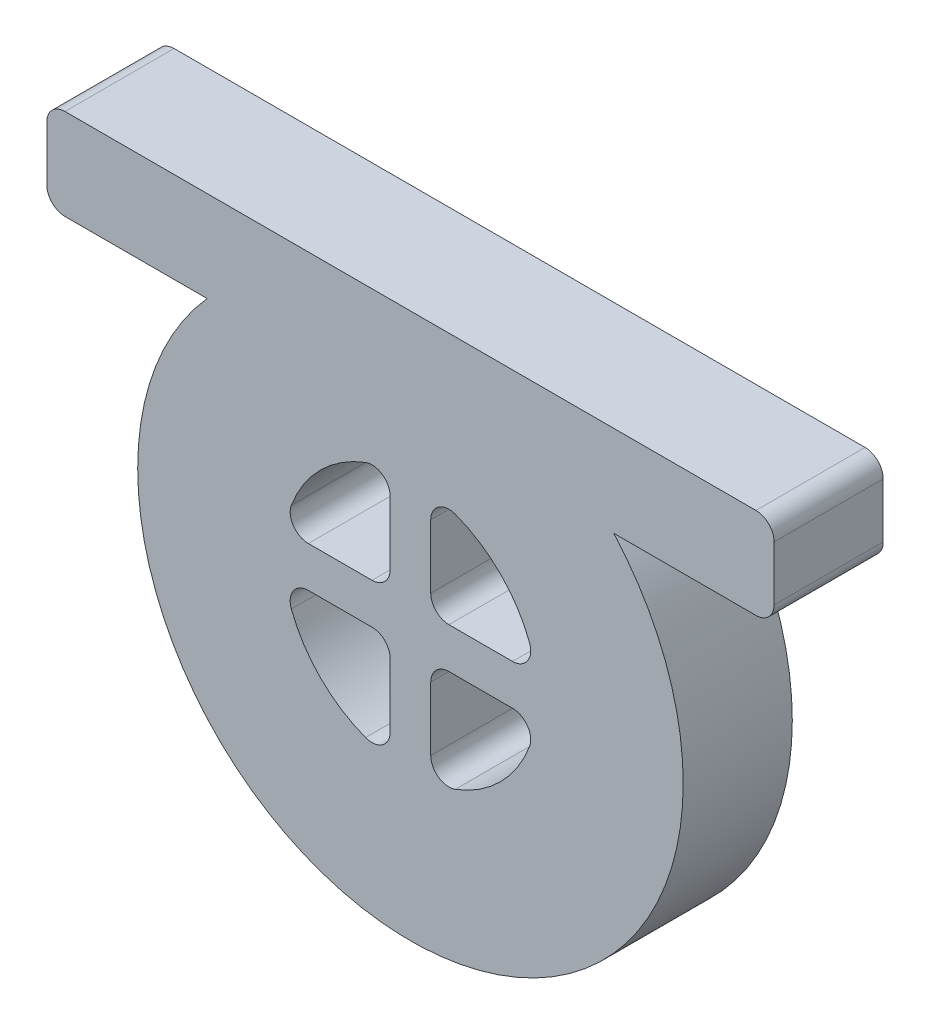
from build123d import *

# Parameters (mm, degrees)
SKETCH2_W           = 40
SKETCH2_H           = 5
SKETCH2_R           = 10
BOSS_EXTRUDE2_DEPTH = 6
FILLET1_R           = 1
FILLET2_R           = 1
FILLET3_R           = 1


with BuildPart() as part:
    # Sketch2 → Boss-Extrude2 (new body)
    # profile 1 of 3: a face of its own
    with BuildSketch(Plane.XY):
        with BuildLine():
            ThreePointArc((-64.563103681, 49.969328221), (-53.382763794, 24.969328221), (-42.202423906, 49.969328221))
            Line((-42.202423906, 49.969328221), (-53.382763794, 49.969328221))
            Line((-53.382763794, 49.969328221), (-64.563103681, 49.969328221))
        make_face()
        with BuildLine():
            ThreePointArc((-43.382763794, 39.969328221), (-60.453831606, 32.89826041), (-53.382763794, 49.969328221))
            ThreePointArc((-53.382763794, 49.969328221), (-46.311695982, 47.040396033), (-43.382763794, 39.969328221))
        make_face(mode=Mode.SUBTRACT)
    # profile 2 of 3: a face of its own
    with BuildSketch(Plane.XY):
        with Locations((-53.382763794, 52.469328221)):
            Rectangle(SKETCH2_W, SKETCH2_H)
    # profile 3 of 3: a face of its own
    with BuildSketch(Plane.XY):
        with Locations((-53.382763794, 39.969328221)):
            Circle(SKETCH2_R)
        with BuildLine():
            ThreePointArc((-52.266628854, 33.05888375), (-48.433016326, 35.019580753), (-46.472319322, 38.853193281))
            Line((-46.472319322, 38.853193281), (-52.266628854, 38.853193281))
            Line((-52.266628854, 38.853193281), (-52.266628854, 33.05888375))
        make_face(mode=Mode.SUBTRACT)
        with BuildLine():
            ThreePointArc((-60.293208266, 38.853193281), (-58.332511262, 35.019580753), (-54.498898734, 33.05888375))
            Line((-54.498898734, 33.05888375), (-54.498898734, 38.853193281))
            Line((-54.498898734, 38.853193281), (-60.293208266, 38.853193281))
        make_face(mode=Mode.SUBTRACT)
        with BuildLine():
            ThreePointArc((-46.472319322, 41.085463162), (-48.433016326, 44.91907569), (-52.266628854, 46.879772693))
            Line((-52.266628854, 46.879772693), (-52.266628854, 41.085463162))
            Line((-52.266628854, 41.085463162), (-46.472319322, 41.085463162))
        make_face(mode=Mode.SUBTRACT)
        with BuildLine():
            ThreePointArc((-54.498898734, 46.879772693), (-58.332511262, 44.91907569), (-60.293208266, 41.085463162))
            Line((-60.293208266, 41.085463162), (-54.498898734, 41.085463162))
            Line((-54.498898734, 41.085463162), (-54.498898734, 46.879772693))
        make_face(mode=Mode.SUBTRACT)
    extrude(amount=BOSS_EXTRUDE2_DEPTH)

    # Fillet1
    fillet1_edges = [part.edges().sort_by_distance(p)[0] for p in [
        (-60.293208266, 41.085463162, 3),
        (-54.498898734, 41.085463162, 3),
        (-54.498898734, 46.879772693, 3),
        (-52.266628854, 46.879772693, 3),
        (-52.266628854, 41.085463162, 3),
        (-46.472319322, 41.085463162, 3),
        (-54.498898734, 33.05888375, 3),
        (-60.293208266, 38.853193281, 3),
        (-46.472319322, 38.853193281, 3),
        (-52.266628854, 33.05888375, 3),
    ]]
    fillet(fillet1_edges, radius=FILLET1_R)

    # Fillet2
    fillet2_edges = [part.edges().sort_by_distance(p)[0] for p in [
        (-54.498898734, 38.853193281, 3),
        (-52.266628854, 38.853193281, 3),
    ]]
    fillet(fillet2_edges, radius=FILLET2_R)

    # Fillet3
    fillet3_edges = [part.edges().sort_by_distance(p)[0] for p in [
        (-73.382763794, 49.969328221, 3),
        (-73.382763794, 54.969328221, 3),
        (-33.382763794, 54.969328221, 3),
        (-33.382763794, 49.969328221, 3),
    ]]
    fillet(fillet3_edges, radius=FILLET3_R)


solid = part.part
